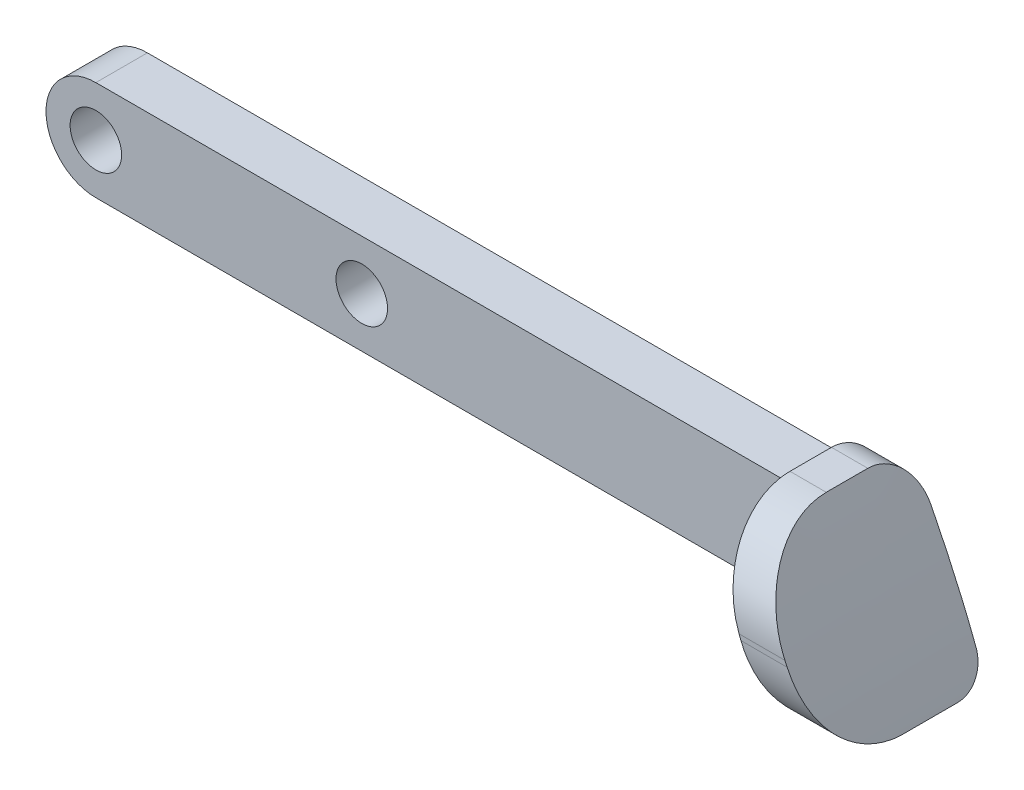
from build123d import *

# Parameters (mm, degrees)
SKETCH_1_R          = 1.55
EXTRUDE_1_DEPTH     = 3.1
CUT_EXTRUDE_1_DEPTH = 10
EXTRUDE_2_DEPTH     = 10
FILLET_2_R          = 5
FILLET_3_R          = 2.5
FILLET_4_R          = 1.7


with BuildPart() as part:
    # 草图1 → 凸台-拉伸1 (new body)
    with BuildSketch(Plane.XY):
        with BuildLine():
            Line((0, 3), (50, 3))
            Line((50, 3), (50, -3))
            Line((50, -3), (0, -3))
            ThreePointArc((0, -3), (-3, 0), (0, 3))
        make_face()
        with Locations(Location((0, 0, 0), (0, 0, 180))):
            Circle(SKETCH_1_R, mode=Mode.SUBTRACT)
        with Locations(Location((16, 0, 0), (0, 0, 180))):
            Circle(SKETCH_1_R, mode=Mode.SUBTRACT)
    extrude(amount=EXTRUDE_1_DEPTH)

    # 草图3 → 切除-拉伸1 (cut)
    with BuildSketch(Plane(origin=(0, 0, 0), x_dir=(-1, 0, 0), z_dir=(0, 0, -1))):
        with BuildLine():
            Line((-44.935370502, 4.01720538), (-56.234181255, 4.01720538))
            Line((-56.234181255, 4.01720538), (-56.234181255, -3.493220576))
            Line((-56.234181255, -3.493220576), (-47.485211089, -3.493220576))
            add(Edge.make_bspline(
                [(-44.935370502, 4.01720538), (-46.990466135, 0.517584736), (-47.485211089, -3.493220576)],
                knots=[0, 0, 0, 1, 1, 1], degree=2))
        make_face()
    extrude(amount=-CUT_EXTRUDE_1_DEPTH, mode=Mode.SUBTRACT)

    # 草图4 → 凸台-拉伸2 (add)
    with BuildSketch(Plane(origin=(0, 0, 0), x_dir=(-1, 0, 0), z_dir=(0, 0, -1))):
        with BuildLine():
            Line((-45.844625562, 5.525178014), (-43.660779358, 5.525178014))
            Line((-43.660779358, 5.525178014), (-47.6508336, -4.768867949))
            Line((-47.6508336, -4.768867949), (-50.463229034, -4.768867949))
            add(Edge.make_bspline(
                [(-45.844625562, 5.525178014), (-47.622517062, 2.212378273), (-49.28905105, -1.189165182), (-50.463229034, -4.768867949)],
                knots=[0, 0, 0, 0, 1, 1, 1, 1], degree=3))
        make_face()
    extrude(amount=-EXTRUDE_2_DEPTH)

    # 圆角2
    fillet_2_edges = [part.edges().sort_by_distance(p)[0] for p in [
        (49.057031317, -4.768867949, 10),
        (44.75270246, 5.525178014, 10),
    ]]
    fillet(fillet_2_edges, radius=FILLET_2_R)

    # 圆角3
    fillet_3_edges = [part.edges().sort_by_distance(p)[0] for p in [
        (44.75270246, 5.525178014, 0),
    ]]
    fillet(fillet_3_edges, radius=FILLET_3_R)

    # 圆角4
    fillet_4_edges = [part.edges().sort_by_distance(p)[0] for p in [
        (49.057031317, -4.768867949, 0),
    ]]
    fillet(fillet_4_edges, radius=FILLET_4_R)


solid = part.part
